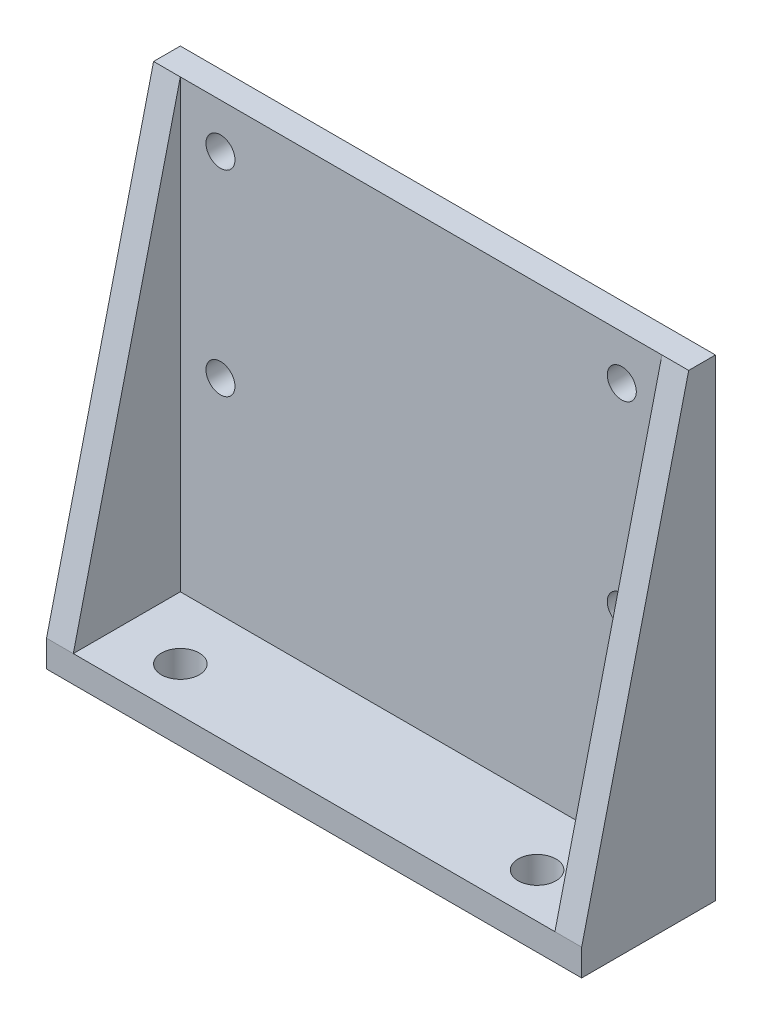
from build123d import *

# Parameters (mm, degrees)
SKETCH1_W           = 60
SKETCH1_H           = 15
SKETCH1_R           = 2.125
BOSS_EXTRUDE1_DEPTH = 3
SKETCH2_W           = 60
SKETCH2_H           = 50
SKETCH2_R           = 1.625
BOSS_EXTRUDE2_DEPTH = 3
BOSS_EXTRUDE3_DEPTH = 3


with BuildPart() as part:
    # Sketch1 → Boss-Extrude1 (new body)
    with BuildSketch(Plane(origin=(0, 0, 0), x_dir=(1, 0, 0), z_dir=(0, 1, 0))):
        with Locations((30, 7.5)):
            Rectangle(SKETCH1_W, SKETCH1_H)
        with Locations(Location((10, 5, 0), (0, 0, 270))):
            Circle(SKETCH1_R, mode=Mode.SUBTRACT)
        with Locations(Location((50, 5, 0), (0, 0, 90))):
            Circle(SKETCH1_R, mode=Mode.SUBTRACT)
    extrude(amount=BOSS_EXTRUDE1_DEPTH)

    # Sketch2 → Boss-Extrude2 (add)
    with BuildSketch(Plane(origin=(0, 0, -15), x_dir=(-1, 0, 0), z_dir=(0, 0, -1))):
        with Locations((-30, 28)):
            Rectangle(SKETCH2_W, SKETCH2_H)
        with Locations((-52.5, 48)):
            Circle(SKETCH2_R, mode=Mode.SUBTRACT)
        with Locations((-52.5, 26)):
            Circle(SKETCH2_R, mode=Mode.SUBTRACT)
        with Locations(Location((-7.5, 26, 0), (0, 0, 180))):
            Circle(SKETCH2_R, mode=Mode.SUBTRACT)
        with Locations(Location((-7.5, 48, 0), (0, 0, 180))):
            Circle(SKETCH2_R, mode=Mode.SUBTRACT)
    extrude(amount=-BOSS_EXTRUDE2_DEPTH)

    # Sketch3 → Boss-Extrude3 (add)
    with BuildSketch(Plane.ZY):
        Polygon((-12, 53), (0, 3), (-12, 3), align=None)
    boss_extrude3 = extrude(amount=-BOSS_EXTRUDE3_DEPTH)

    # Mirror1: Boss-Extrude3 across plane
    add(boss_extrude3.mirror(Plane.ZY.offset(-30)))


solid = part.part
